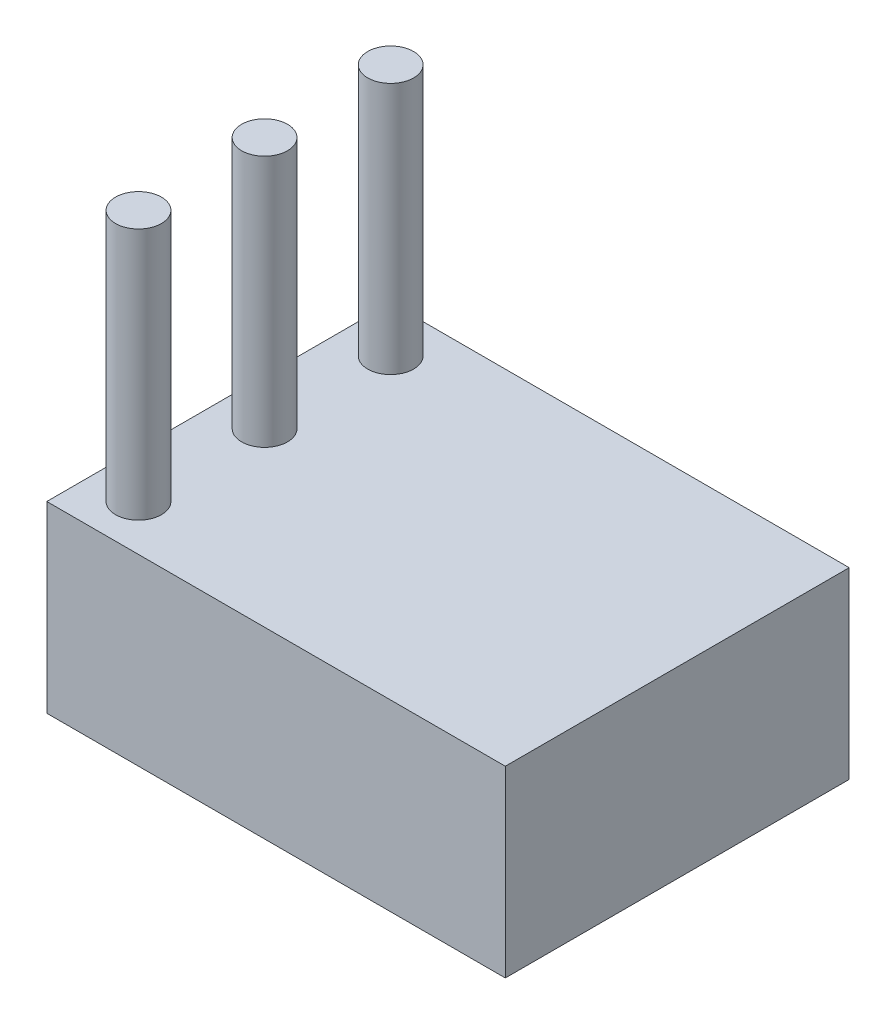
from build123d import *

# Parameters (mm, degrees)
SKETCH1_W           = 50.8
SKETCH1_H           = 38.1
BOSS_EXTRUDE1_DEPTH = 20.32
SKETCH2_R           = 2.54
BOSS_EXTRUDE2_DEPTH = 27.94


with BuildPart() as part:
    # Sketch1 → Boss-Extrude1 (new body)
    with BuildSketch(Plane(origin=(0, 0, 0), x_dir=(1, 0, 0), z_dir=(0, 1, 0))):
        Rectangle(SKETCH1_W, SKETCH1_H)
    extrude(amount=BOSS_EXTRUDE1_DEPTH)

    # Sketch2 → Boss-Extrude2 (add)
    with BuildSketch(Plane(origin=(0, 20.32, 0), x_dir=(1, 0, 0), z_dir=(0, 1, 0))):
        with Locations(Location((-20.32, 13.97, 0), (0, 0, 90))):
            Circle(SKETCH2_R)
        with Locations(Location((-20.32, -13.97, 0), (0, 0, 90))):
            Circle(SKETCH2_R)
        with Locations(Location((-20.32, 0, 0), (0, 0, 90))):
            Circle(SKETCH2_R)
    extrude(amount=BOSS_EXTRUDE2_DEPTH)


solid = part.part
